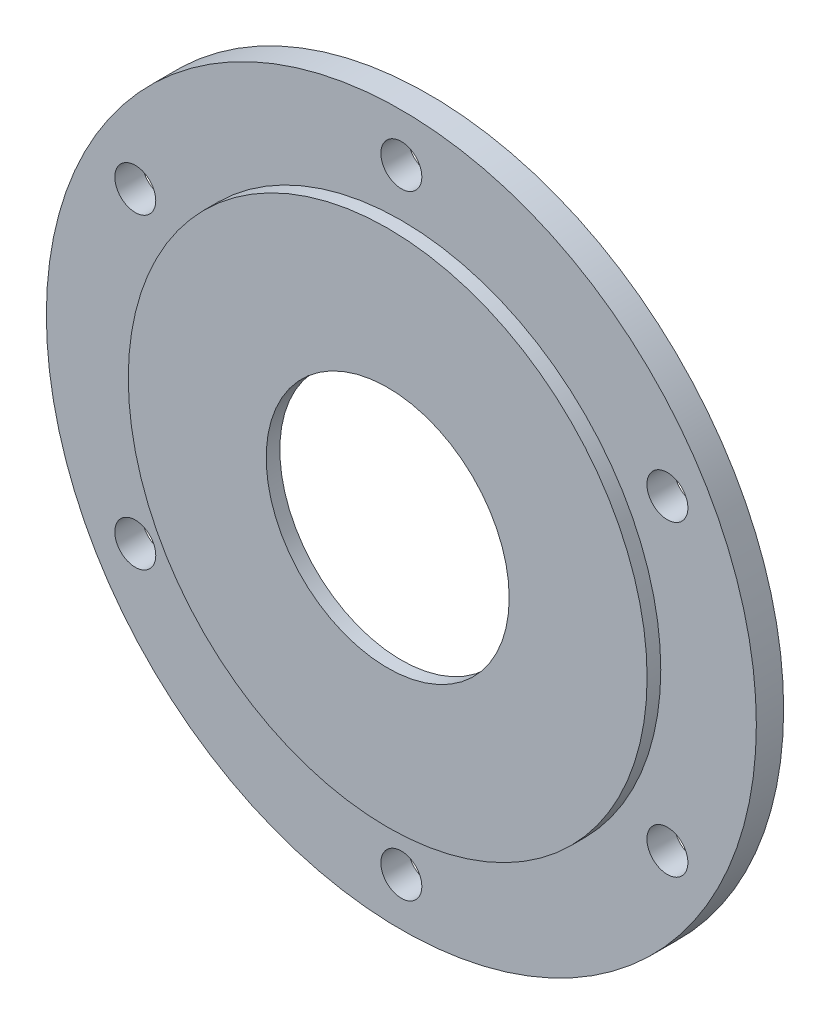
from build123d import *

# Parameters (mm, degrees)
CROQUIS1_R              = 19
CROQUIS1_R_2            = 8.9
SALIENTE_EXTRUIR1_DEPTH = 1
CROQUIS2_R              = 26
CROQUIS2_R_2            = 19
SALIENTE_EXTRUIR2_DEPTH = 2
CROQUIS3_R              = 1.5
CORTAR_EXTRUIR1_DEPTH   = 3


with BuildPart() as part:
    # Croquis1 → Saliente-Extruir1 (new body)
    with BuildSketch(Plane.XY):
        Circle(CROQUIS1_R)
        Circle(CROQUIS1_R_2, mode=Mode.SUBTRACT)
    extrude(amount=SALIENTE_EXTRUIR1_DEPTH)


with BuildPart() as body_2:
    # Croquis2 → Saliente-Extruir2 (new body)
    with BuildSketch(Plane(origin=(0, 0, 0), x_dir=(-1, 0, 0), z_dir=(0, 0, -1))):
        Circle(CROQUIS2_R)
        Circle(CROQUIS2_R_2, mode=Mode.SUBTRACT)
    extrude(amount=SALIENTE_EXTRUIR2_DEPTH)

    # Croquis3 → Cortar-Extruir1 (cut)
    with BuildSketch(Plane.XY):
        with Locations((0, 22.5)):
            Circle(CROQUIS3_R)
        with Locations((19.485571585, 11.25)):
            Circle(CROQUIS3_R)
        with Locations((19.485571585, -11.25)):
            Circle(CROQUIS3_R)
        with Locations((0, -22.5)):
            Circle(CROQUIS3_R)
        with Locations((-19.485571585, -11.25)):
            Circle(CROQUIS3_R)
        with Locations((-19.485571585, 11.25)):
            Circle(CROQUIS3_R)
    extrude(amount=-CORTAR_EXTRUIR1_DEPTH, mode=Mode.SUBTRACT)


solid = Compound([part.part, body_2.part])
